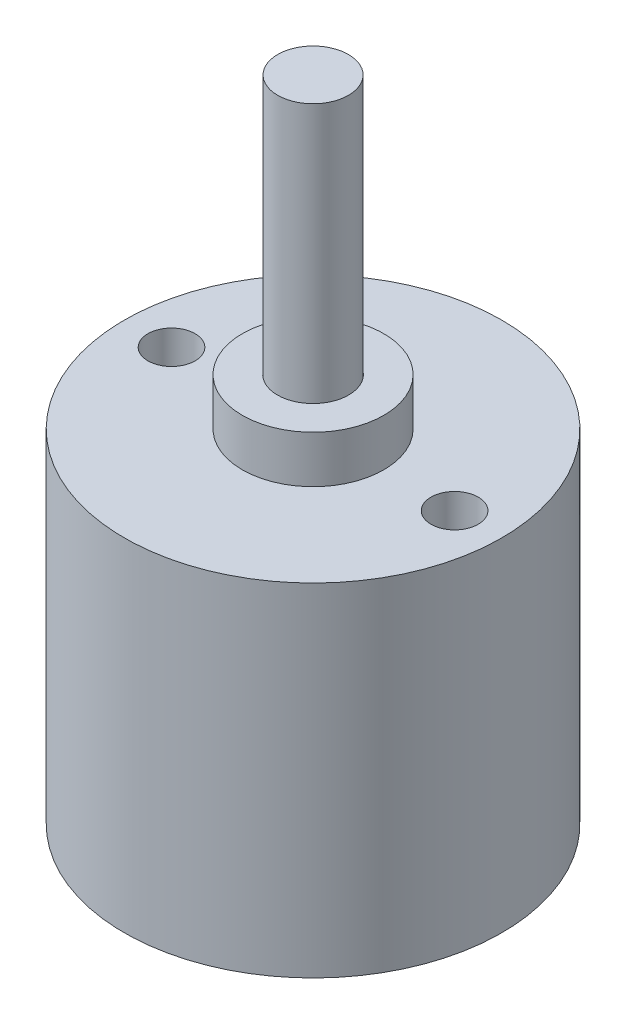
from build123d import *

# Parameters (mm, degrees)
CROQUIS1_R              = 8
SALIENTE_EXTRUIR1_DEPTH = 14.5
CROQUIS2_R              = 1
CROQUIS2_R_2            = 1.51
CORTAR_EXTRUIR1_DEPTH   = 5
SALIENTE_EXTRUIR2_START = 2
CROQUIS3_R              = 3
CROQUIS3_R_2            = 1.51
SALIENTE_EXTRUIR2_DEPTH = 2
CROQUIS4_R              = 1.5
SALIENTE_EXTRUIR3_DEPTH = 18


with BuildPart() as part:
    # Croquis1 → Saliente-Extruir1 (new body)
    with BuildSketch(Plane(origin=(0, 0, 0), x_dir=(1, 0, 0), z_dir=(0, 1, 0))):
        with Locations(Location((0, 0, 0), (0, 0, 90))):
            Circle(CROQUIS1_R)
    extrude(amount=SALIENTE_EXTRUIR1_DEPTH)

    # Croquis2 → Cortar-Extruir1 (cut)
    with BuildSketch(Plane(origin=(0, 14.5, 0), x_dir=(1, 0, 0), z_dir=(0, 1, 0))):
        with Locations(Location((6, 0, 0), (0, 0, 270))):
            Circle(CROQUIS2_R)
        with Locations(Location((-6, 0, 0), (0, 0, 270))):
            Circle(CROQUIS2_R)
        with Locations(Location((0, 0, 0), (0, 0, 270))):
            Circle(CROQUIS2_R_2)
    extrude(amount=-CORTAR_EXTRUIR1_DEPTH, mode=Mode.SUBTRACT)

    # Croquis3 → Saliente-Extruir2 (add)
    with BuildSketch(Plane(origin=(0, 14.5, 0), x_dir=(1, 0, 0), z_dir=(0, 1, 0)).offset(SALIENTE_EXTRUIR2_START)):
        with Locations(Location((0, 0, 0), (0, 0, 270))):
            Circle(CROQUIS3_R)
        with Locations(Location((0, 0, 0), (0, 0, 270))):
            Circle(CROQUIS3_R_2, mode=Mode.SUBTRACT)
    extrude(amount=-SALIENTE_EXTRUIR2_DEPTH)

    # Croquis4 → Saliente-Extruir3 (add)
    with BuildSketch(Plane(origin=(0, 9.5, 0), x_dir=(1, 0, 0), z_dir=(0, 1, 0))):
        with Locations(Location((0, 0, 0), (0, 0, 270))):
            Circle(CROQUIS4_R)
    extrude(amount=SALIENTE_EXTRUIR3_DEPTH)


solid = part.part
